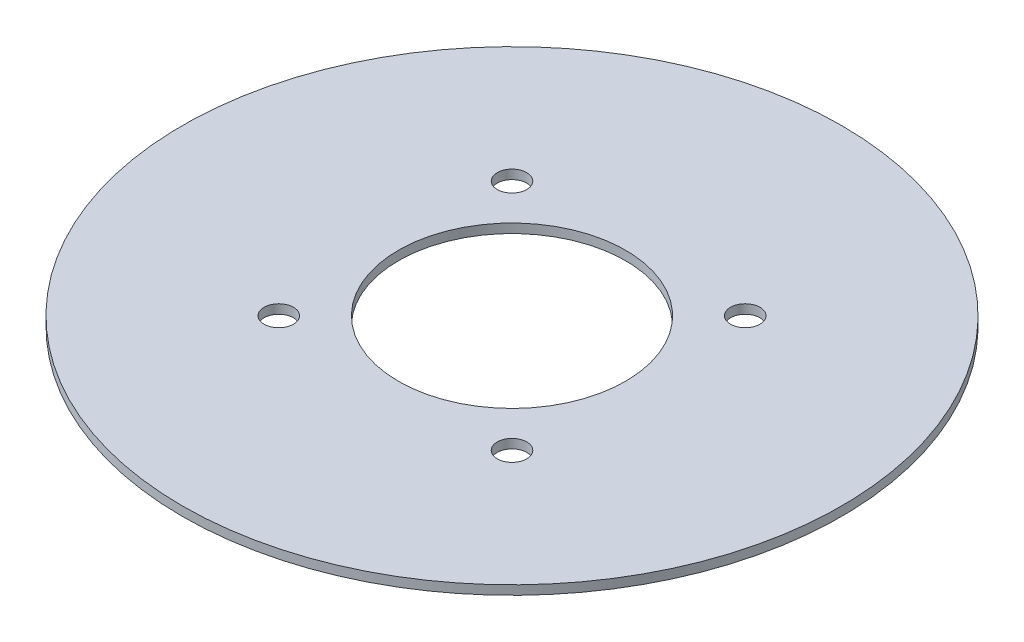
from build123d import *

# Parameters (mm, degrees)
SKETCH_1_R          = 32.5
EXTRUDE_1_DEPTH     = 0.9
SKETCH_2_R          = 1.45
SKETCH_2_R_2        = 11.2
CUT_EXTRUDE_1_DEPTH = 0.9


with BuildPart() as part:
    # 草图1 → 凸台-拉伸1 (new body)
    with BuildSketch(Plane(origin=(0, 606.003613165, 0), x_dir=(1, 0, 0), z_dir=(0, 1, 0))):
        with Locations(Location((0, 0, 0), (0, 0, 270))):
            Circle(SKETCH_1_R)
    extrude(amount=EXTRUDE_1_DEPTH)

    # 草图2 → 切除-拉伸1 (cut)
    with BuildSketch(Plane(origin=(0, 606.903613165, 0), x_dir=(1, 0, 0), z_dir=(0, 1, 0))):
        with Locations(Location((11.5, 11.5, 0), (0, 0, 270))):
            Circle(SKETCH_2_R)
        with Locations(Location((11.5, -11.5, 0), (0, 0, 270))):
            Circle(SKETCH_2_R)
        with Locations(Location((-11.5, -11.5, 0), (0, 0, 270))):
            Circle(SKETCH_2_R)
        with Locations(Location((-11.5, 11.5, 0), (0, 0, 270))):
            Circle(SKETCH_2_R)
        with Locations(Location((0, 0, 0), (0, 0, 270))):
            Circle(SKETCH_2_R_2)
    extrude(amount=-CUT_EXTRUDE_1_DEPTH, mode=Mode.SUBTRACT)


solid = part.part
